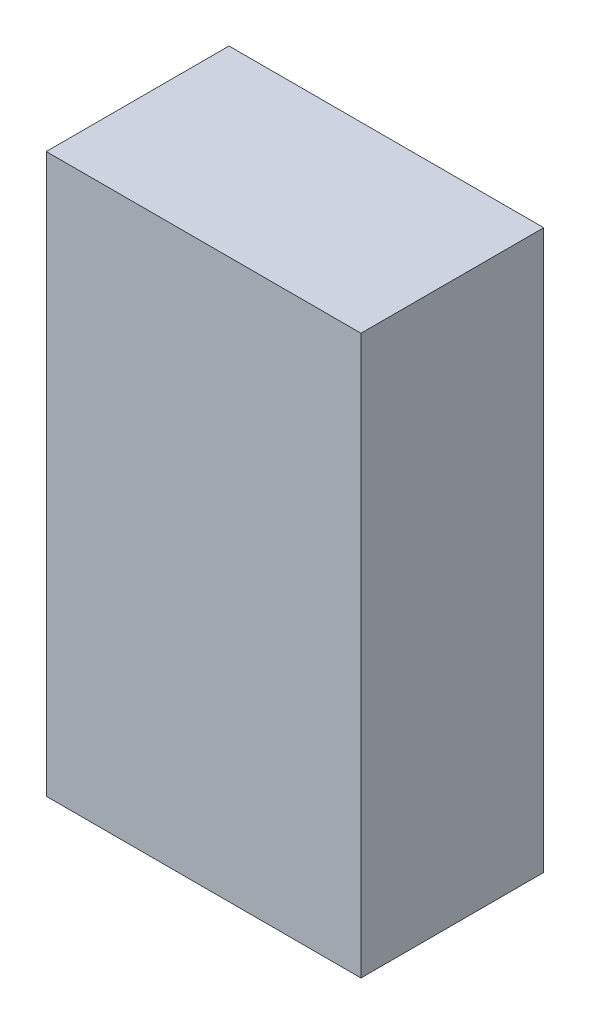
from build123d import *

# Parameters (mm, degrees)
SKETCH1_W           = 31
SKETCH1_H           = 18
BOSS_EXTRUDE1_DEPTH = 55


with BuildPart() as part:
    # Sketch1 → Boss-Extrude1 (new body)
    with BuildSketch(Plane(origin=(0, 0, 0), x_dir=(1, 0, 0), z_dir=(0, 1, 0))):
        Rectangle(SKETCH1_W, SKETCH1_H)
    extrude(amount=BOSS_EXTRUDE1_DEPTH)


solid = part.part
